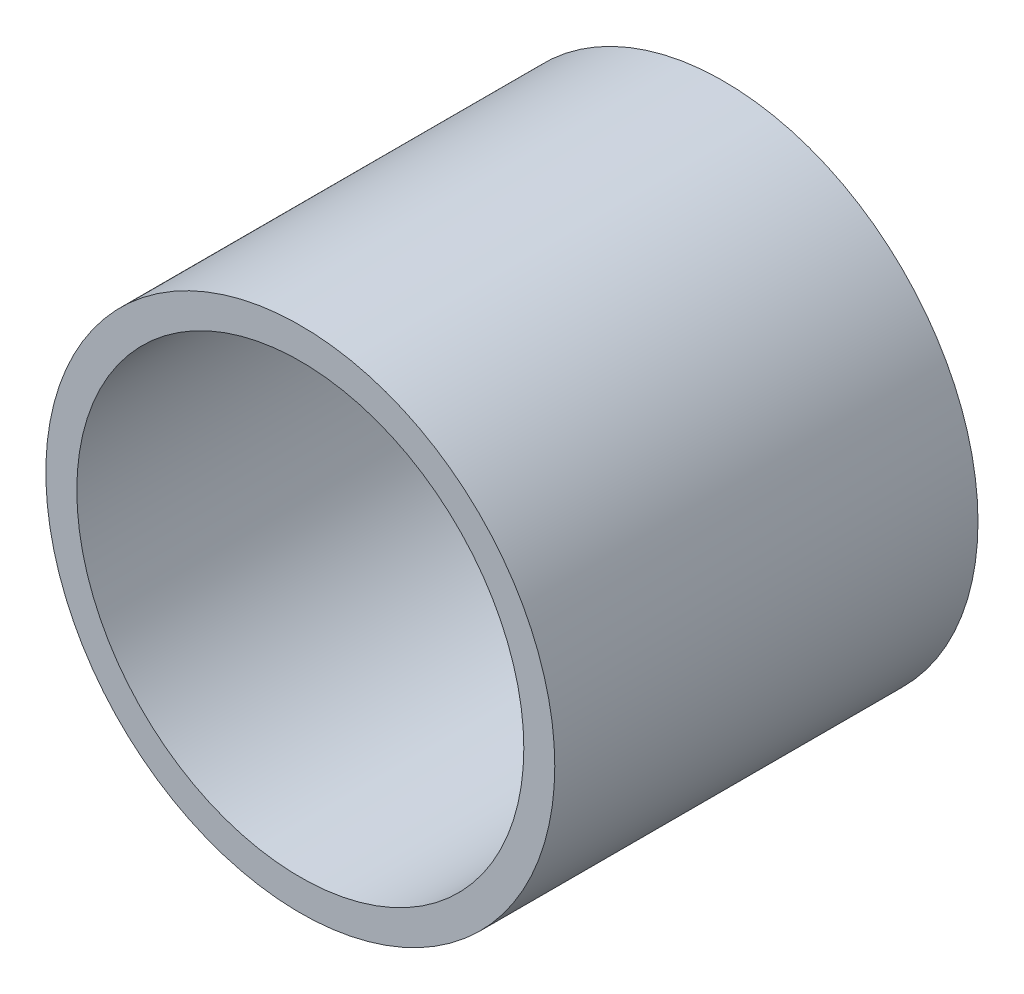
from build123d import *

# Parameters (mm, degrees)
SKETCH1_R           = 6.262000049
SKETCH1_R_2         = 5.5
BOSS_EXTRUDE1_DEPTH = 10.414


with BuildPart() as part:
    # Sketch1 → Boss-Extrude1 (new body)
    with BuildSketch(Plane(origin=(0, 0, 0), x_dir=(0, 1, 0), z_dir=(0, 0, 1))):
        with Locations(Location((0, 0, 0), (0, 0, 270))):
            Circle(SKETCH1_R)
        with Locations(Location((0, 0, 0), (0, 0, 270))):
            Circle(SKETCH1_R_2, mode=Mode.SUBTRACT)
    extrude(amount=BOSS_EXTRUDE1_DEPTH)


solid = part.part
